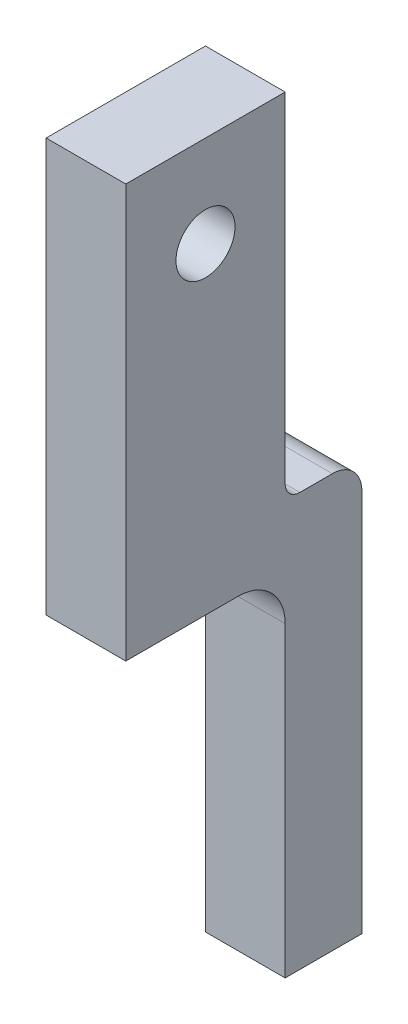
from build123d import *

# Parameters (mm, degrees)
BOSS_EXTRUDE1_DEPTH = 135
SKETCH2_W           = 135
SKETCH2_H           = 270
BOSS_EXTRUDE2_DEPTH = 300
SKETCH3_R           = 50
CUT_EXTRUDE1_DEPTH  = 1070.285321259


with BuildPart() as part:
    # Sketch1 → Boss-Extrude1 (new body)
    with BuildSketch(Plane(origin=(0, 0, 0), x_dir=(0, 0, -1), z_dir=(1, 0, 0))):
        with BuildLine():
            Line((-465.792131575, 464.039290463), (-465.792131575, 189.039290463))
            ThreePointArc((-465.792131575, 189.039290463), (-458.469801105, 171.361620934), (-440.792131575, 164.039290463))
            Line((-440.792131575, 164.039290463), (-385.792131575, 164.039290463))
            ThreePointArc((-385.792131575, 164.039290463), (-350.436792516, 149.394629523), (-335.792131575, 114.039290463))
            Line((-335.792131575, 114.039290463), (-335.792131575, -535.960709537))
            Line((-335.792131575, -535.960709537), (-465.792131575, -535.960709537))
            Line((-465.792131575, -535.960709537), (-465.792131575, -15.960709537))
            ThreePointArc((-465.792131575, -15.960709537), (-489.22358908, 40.607832958), (-545.792131575, 64.039290463))
            Line((-545.792131575, 64.039290463), (-735.792131575, 64.039290463))
            Line((-735.792131575, 64.039290463), (-735.792131575, 464.039290463))
            Line((-735.792131575, 464.039290463), (-465.792131575, 464.039290463))
        make_face()
    extrude(amount=BOSS_EXTRUDE1_DEPTH)

    # Sketch2 → Boss-Extrude2 (add)
    with BuildSketch(Plane(origin=(0, 464.039290463, 0), x_dir=(1, 0, 0), z_dir=(0, 1, 0))):
        with Locations((67.5, -600.792131575)):
            Rectangle(SKETCH2_W, SKETCH2_H)
    extrude(amount=BOSS_EXTRUDE2_DEPTH)

    # Sketch3 → Cut-Extrude1 (cut, through all)
    with BuildSketch(Plane(origin=(135, 0, 0), x_dir=(0, 0, -1), z_dir=(1, 0, 0))):
        with Locations((-600.792131575, 609.039290463)):
            Circle(SKETCH3_R)
    extrude(amount=-CUT_EXTRUDE1_DEPTH, mode=Mode.SUBTRACT)


solid = part.part
